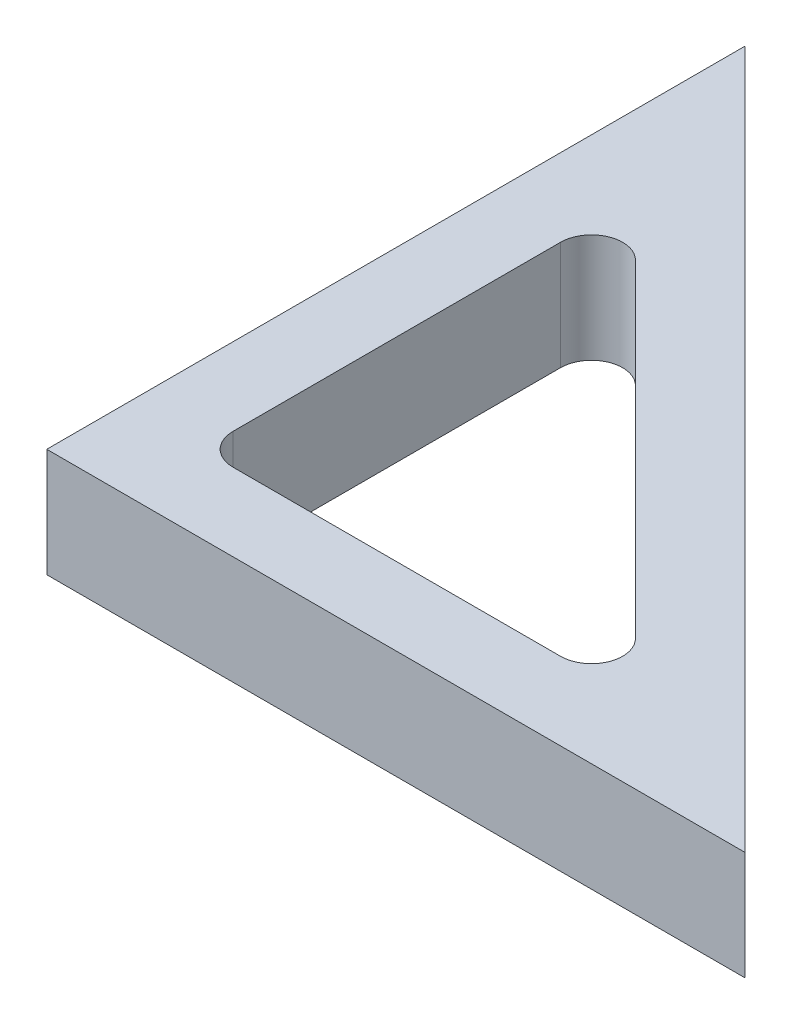
from build123d import *

# Parameters (mm, degrees)
BOSS_EXTRUDE1_DEPTH = 7


with BuildPart() as part:
    # Sketch1 → Boss-Extrude1 (new body)
    with BuildSketch(Plane(origin=(0, 0, 0), x_dir=(1, 0, 0), z_dir=(0, 1, 0))):
        Polygon((0, 0), (0, 45), (45, 0), align=None)
        with BuildLine():
            Line((5, 7), (5, 28.100505063))
            ThreePointArc((5, 28.100505063), (6.234633135, 29.948264128), (8.414213562, 29.514718626))
            Line((8.414213562, 29.514718626), (29.514718626, 8.414213562))
            ThreePointArc((29.514718626, 8.414213562), (29.948264128, 6.234633135), (28.100505063, 5))
            Line((28.100505063, 5), (7, 5))
            ThreePointArc((7, 5), (5.585786438, 5.585786438), (5, 7))
        make_face(mode=Mode.SUBTRACT)
    extrude(amount=BOSS_EXTRUDE1_DEPTH)


solid = part.part
